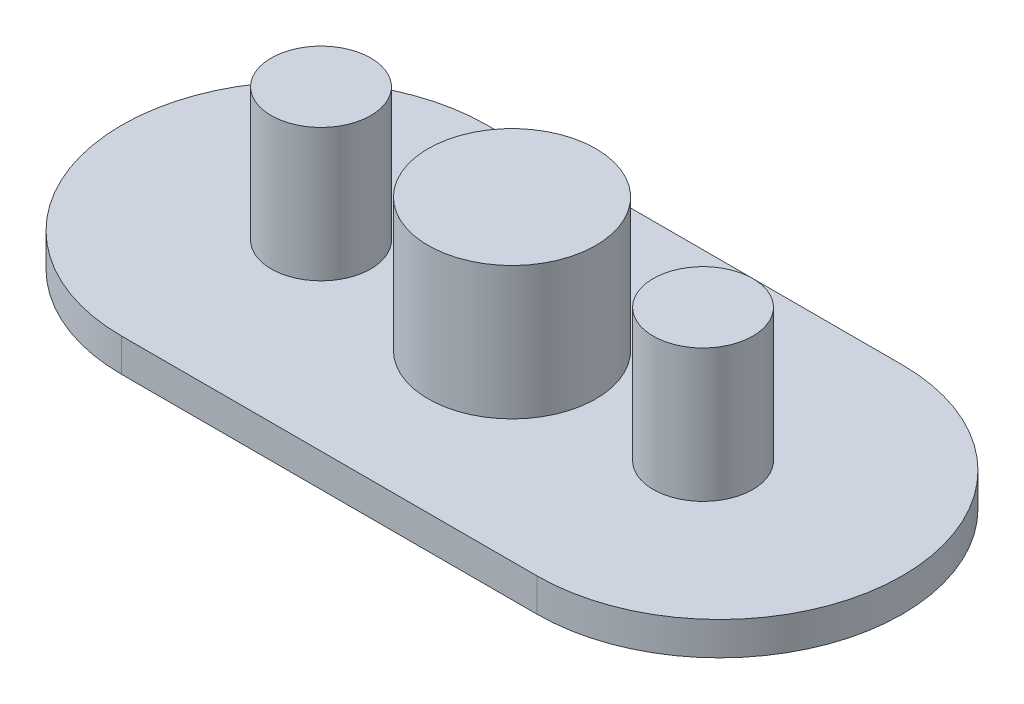
from build123d import *

# Parameters (mm, degrees)
BOSS_EXTRUDE10_DEPTH = 2
SKETCH14_R           = 3
SKETCH14_R_2         = 5.05
BOSS_EXTRUDE11_DEPTH = 8


with BuildPart() as part:
    # Sketch13 → Boss-Extrude10 (new body)
    with BuildSketch(Plane(origin=(-28.225984218, 0, 0), x_dir=(-1, 0, 0), z_dir=(0, -1, 0))):
        with BuildLine():
            Line((-40.725984218, 11), (-15.725984218, 11))
            ThreePointArc((-15.725984218, 11), (-4.725984218, 0), (-15.725984218, -11))
            Line((-15.725984218, -11), (-40.725984218, -11))
            ThreePointArc((-40.725984218, -11), (-51.725984218, 0), (-40.725984218, 11))
        make_face()
    extrude(amount=BOSS_EXTRUDE10_DEPTH)

    # Sketch14 → Boss-Extrude11 (add)
    with BuildSketch(Plane.XZ):
        with Locations((-11.5, 0)):
            Circle(SKETCH14_R)
        Circle(SKETCH14_R_2)
        with Locations((11.5, 0)):
            Circle(SKETCH14_R)
    extrude(amount=-BOSS_EXTRUDE11_DEPTH)


solid = part.part
